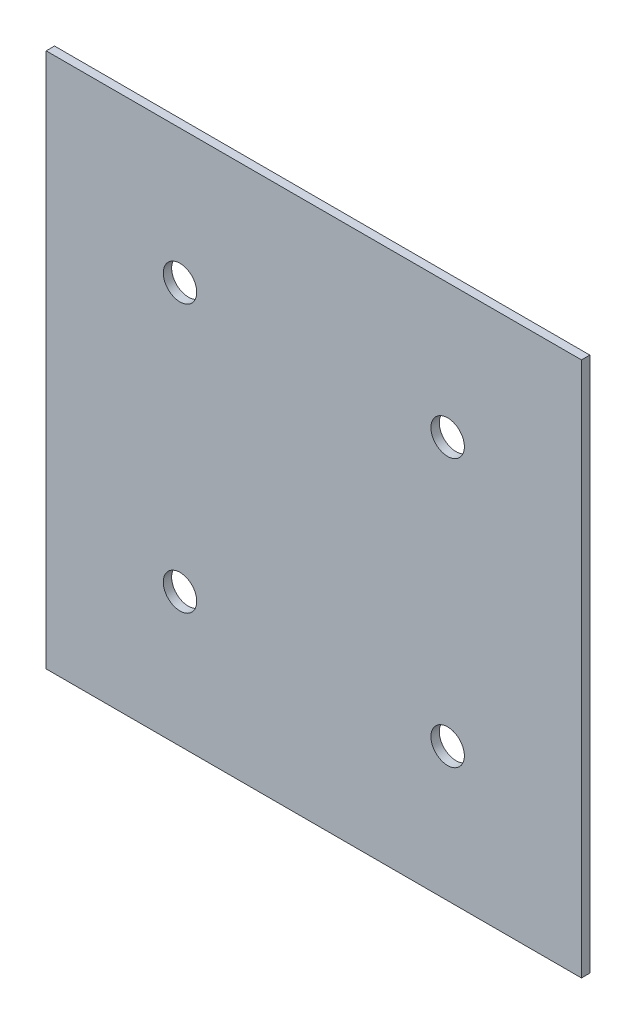
from build123d import *

# Parameters (mm, degrees)
SKETCH_1_W                  = 160
SKETCH_1_H                  = 160
EXTRUDE_1_DEPTH             = 2.5
SKETCH_2_R                  = 5
CUT_EXTRUDE_1_DEPTH         = 227.287980238
PATTERN_LINEAR_1_COUNT      = 2
PATTERN_LINEAR_1_PITCH      = 80
PATTERN_LINEAR_1_COUNT_DIR2 = 2
PATTERN_LINEAR_1_PITCH_DIR2 = 80


with BuildPart() as part:
    # 草图1 → 凸台-拉伸1 (new body)
    with BuildSketch(Plane.XY):
        with Locations((80, 80)):
            Rectangle(SKETCH_1_W, SKETCH_1_H)
    extrude(amount=EXTRUDE_1_DEPTH)

    # 草图2 → 切除-拉伸1 (cut, through all)
    with BuildSketch(Plane.XY.offset(2.5)):
        with Locations((40, 120)):
            Circle(SKETCH_2_R)
    cut_extrude_1 = extrude(amount=-CUT_EXTRUDE_1_DEPTH, mode=Mode.SUBTRACT)

    # 阵列(线性)1: Cut-Extrude 1 2 × 2
    with Locations(*[(i * PATTERN_LINEAR_1_PITCH, -j * PATTERN_LINEAR_1_PITCH_DIR2, 0) for i in range(PATTERN_LINEAR_1_COUNT) for j in range(PATTERN_LINEAR_1_COUNT_DIR2) if (i, j) != (0, 0)]):
        add(cut_extrude_1, mode=Mode.SUBTRACT)


solid = part.part
